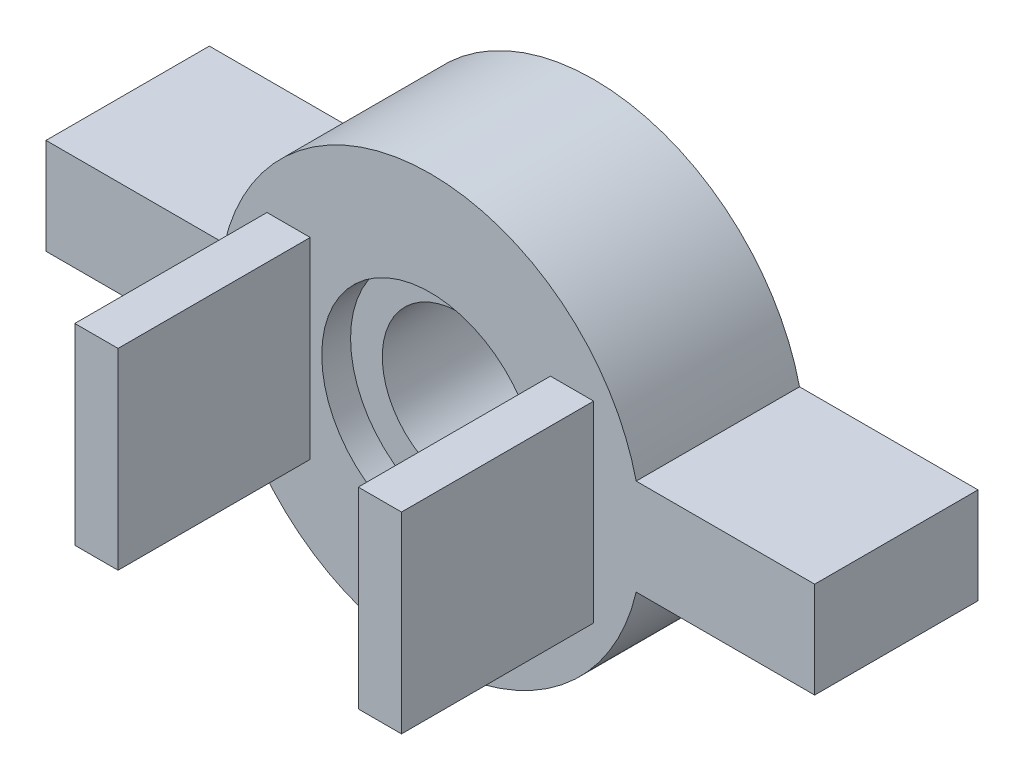
from build123d import *

# Parameters (mm, degrees)
BOSS_EXTRUDE1_DEPTH = 8.5
CUT_EXTRUDE1_REACH  = 26.357
SKETCH2_R           = 4
SKETCH3_W           = 2.25
SKETCH3_H           = 10
BOSS_EXTRUDE3_DEPTH = 10
SKETCH4_R           = 5.65
CUT_EXTRUDE2_DEPTH  = 1.5


with BuildPart() as part:
    # Sketch1 → Boss-Extrude1 (new body)
    with BuildSketch(Plane.XY):
        with BuildLine():
            Line((10.712142643, 2.5), (20, 2.5))
            Line((20, 2.5), (20, -2.5))
            Line((20, -2.5), (10.712142643, -2.5))
            ThreePointArc((10.712142643, -2.5), (0, -11), (-10.712142643, -2.5))
            Line((-10.712142643, -2.5), (-20, -2.5))
            Line((-20, -2.5), (-20, 2.5))
            Line((-20, 2.5), (-10.712142643, 2.5))
            ThreePointArc((-10.712142643, 2.5), (0, 11), (10.712142643, 2.5))
        make_face()
    extrude(amount=BOSS_EXTRUDE1_DEPTH)

    # Sketch2 → Cut-Extrude1 (cut, up to next)
    with BuildSketch(Plane.XY.offset(8.5), mode=Mode.PRIVATE) as cut_extrude1_sk1:
        Circle(SKETCH2_R)
    cut_extrude1_tool1 = extrude(cut_extrude1_sk1.sketch, amount=-CUT_EXTRUDE1_REACH, mode=Mode.PRIVATE) & part.part
    add(cut_extrude1_tool1.solids().sort_by_distance((0, 0, 8.5))[0], mode=Mode.SUBTRACT)

    # Sketch3 → Boss-Extrude3 (add)
    with BuildSketch(Plane.XY.offset(8.5)):
        with Locations((7.375, 0)):
            Rectangle(SKETCH3_W, SKETCH3_H)
        with Locations((-7.375, 0)):
            Rectangle(SKETCH3_W, SKETCH3_H)
    extrude(amount=BOSS_EXTRUDE3_DEPTH)

    # Sketch4 → Cut-Extrude2 (cut)
    with BuildSketch(Plane.XY.offset(8.5)):
        Circle(SKETCH4_R)
    extrude(amount=-CUT_EXTRUDE2_DEPTH, mode=Mode.SUBTRACT)


solid = part.part
